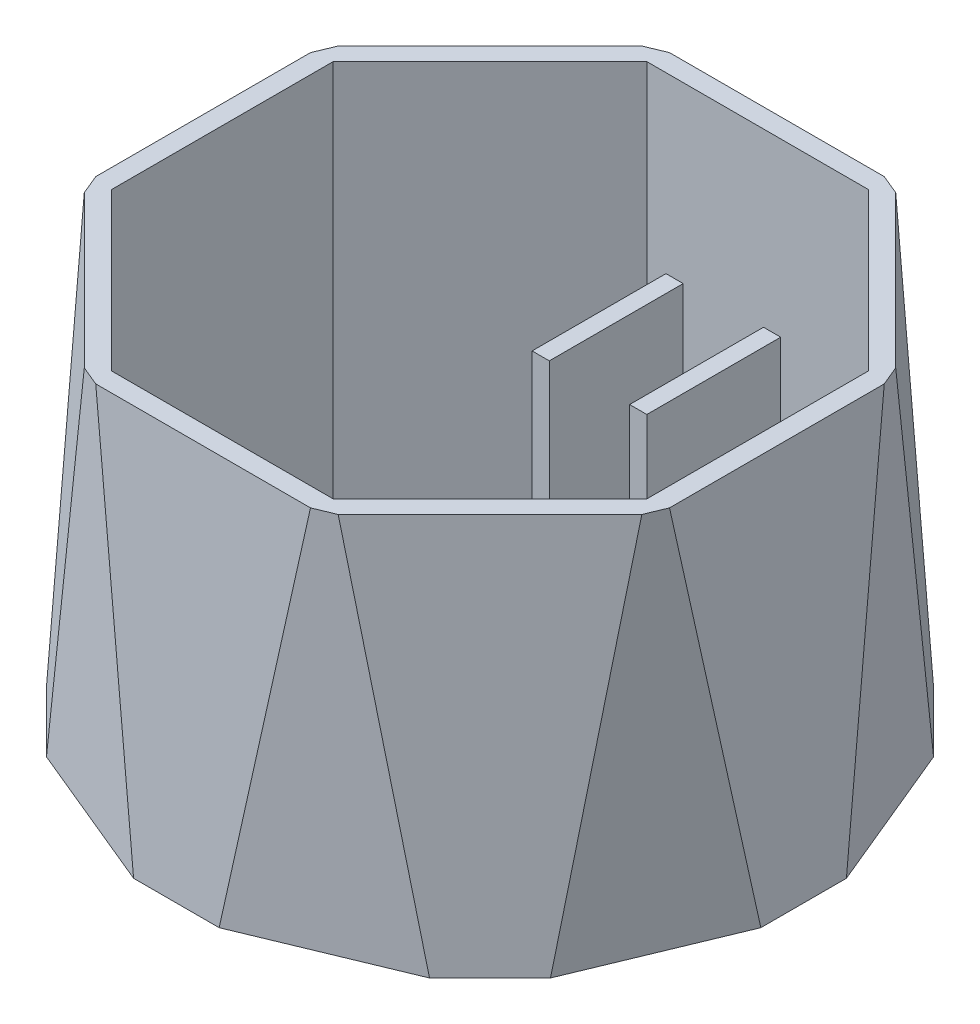
from build123d import *

# Parameters (mm, degrees)
BOSS_EXTRUDE2_DEPTH = 100
SKETCH2_W           = 4.5
SKETCH2_H           = 54.5
BOSS_EXTRUDE3_DEPTH = 35
CHAMFER1_SIZE       = 3
DRAFT2_ANGLE        = 4


with BuildPart() as part:
    # Sketch1 → Boss-Extrude2 (new body)
    with BuildSketch(Plane(origin=(0, 0, 0), x_dir=(1, 0, 0), z_dir=(0, 1, 0))):
        Polygon((-31.066017178, -75), (31.066017178, -75), (75, -31.066017178), (75, 31.066017178), (31.066017178, 75), (-31.066017178, 75), (-75, 31.066017178), (-75, -31.066017178), align=None)
        Polygon((28.994949366, -70), (70, -28.994949366), (70, 28.994949366), (28.994949366, 70), (-28.994949366, 70), (-70, 28.994949366), (-70, -28.994949366), (-28.994949366, -70), align=None, mode=Mode.SUBTRACT)
    extrude(amount=BOSS_EXTRUDE2_DEPTH)

    # Sketch2 → Boss-Extrude3 (add)
    with BuildSketch(Plane.XY.offset(-70)):
        with Locations((-21.744949366, 27.25)):
            Rectangle(SKETCH2_W, SKETCH2_H)
        with Locations((3.755050634, 27.860857485)):
            Rectangle(SKETCH2_W, SKETCH2_H)
    extrude(amount=BOSS_EXTRUDE3_DEPTH)

    # Chamfer1
    chamfer1_edges = [part.edges().sort_by_distance(p)[0] for p in [
        (-31.066017178, 50, 75),
        (-75, 50, 31.066017178),
        (-75, 50, -31.066017178),
        (-31.066017178, 50, -75),
        (31.066017178, 50, -75),
        (75, 50, -31.066017178),
        (75, 50, 31.066017178),
        (31.066017178, 50, 75),
    ]]
    chamfer(chamfer1_edges, length=CHAMFER1_SIZE)

    # Draft2
    draft2_faces = [part.faces().sort_by_distance(p)[0] for p in [
        (53.033008589, 50, -53.033008589),
        (0, 50, -75),
        (-53.033008589, 50, -53.033008589),
        (-75, 50, 0),
        (-53.033008589, 50, 53.033008589),
        (0, 50, 75),
        (53.033008589, 50, 53.033008589),
        (75, 50, 0),
    ]]
    draft(draft2_faces, Plane.ZX.offset(100), DRAFT2_ANGLE)


solid = part.part
